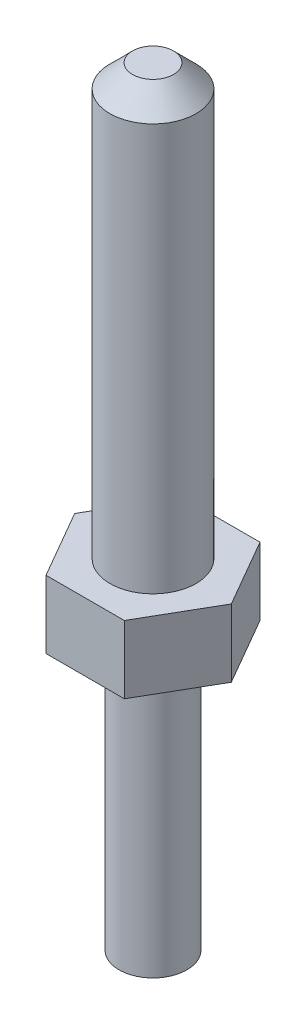
from build123d import *

# Parameters (mm, degrees)
BOSS_EXTRUDE1_DEPTH = 3
CHAMFER1_SIZE       = 1


with BuildPart() as part:
    # Sketch1 → Revolve1 (revolve)
    with BuildSketch(Plane.XY, mode=Mode.PRIVATE) as revolve1_sk:
        Polygon((0, 34), (-1.905, 34), (-1.905, 15), (-2.5, 15), (-2.5, 12), (-1.5, 12), (-1.5, 0), (0, 0), align=None)
    revolve(revolve1_sk.sketch.rotate(Axis((0, 0, 0), (0, 1, 0)), 270), axis=Axis((0, 0, 0), (0, 1, 0)))

    # Sketch2 → Boss-Extrude1 (add)
    with BuildSketch(Plane(origin=(0, 15, 0), x_dir=(1, 0, 0), z_dir=(0, 1, 0))):
        Polygon((-3.464101615, 0), (-1.732050808, -3), (1.732050808, -3), (3.464101615, 0), (1.732050808, 3), (-1.732050808, 3), align=None)
    extrude(amount=-BOSS_EXTRUDE1_DEPTH)

    # Chamfer1
    chamfer1_edges = [part.edges().sort_by_distance(p)[0] for p in [
        (0, 34, 1.905),
    ]]
    chamfer(chamfer1_edges, length=CHAMFER1_SIZE)


solid = part.part
